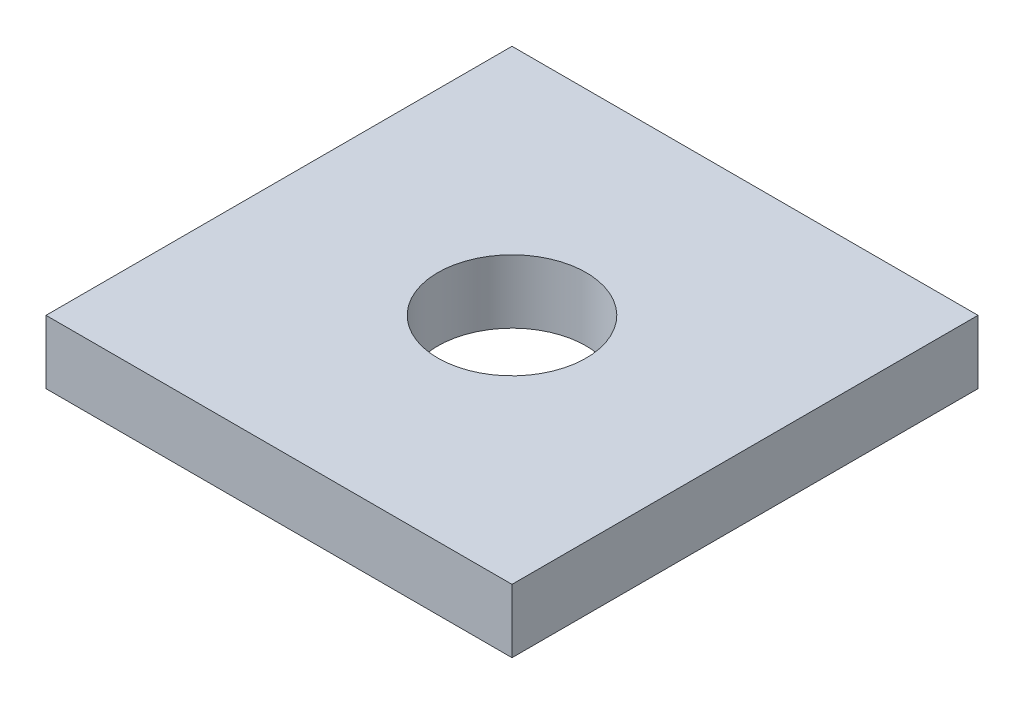
from build123d import *

# Parameters (mm, degrees)
SKETCH1_W           = 22
SKETCH1_H           = 22
SKETCH1_R           = 3.5
BOSS_EXTRUDE1_DEPTH = 3


with BuildPart() as part:
    # Sketch1 → Boss-Extrude1 (new body)
    with BuildSketch(Plane(origin=(0, 0, 0), x_dir=(1, 0, 0), z_dir=(0, 1, 0))):
        Rectangle(SKETCH1_W, SKETCH1_H)
        with Locations(Location((0, 0, 0), (0, 0, 270))):
            Circle(SKETCH1_R, mode=Mode.SUBTRACT)
    extrude(amount=BOSS_EXTRUDE1_DEPTH)


solid = part.part
